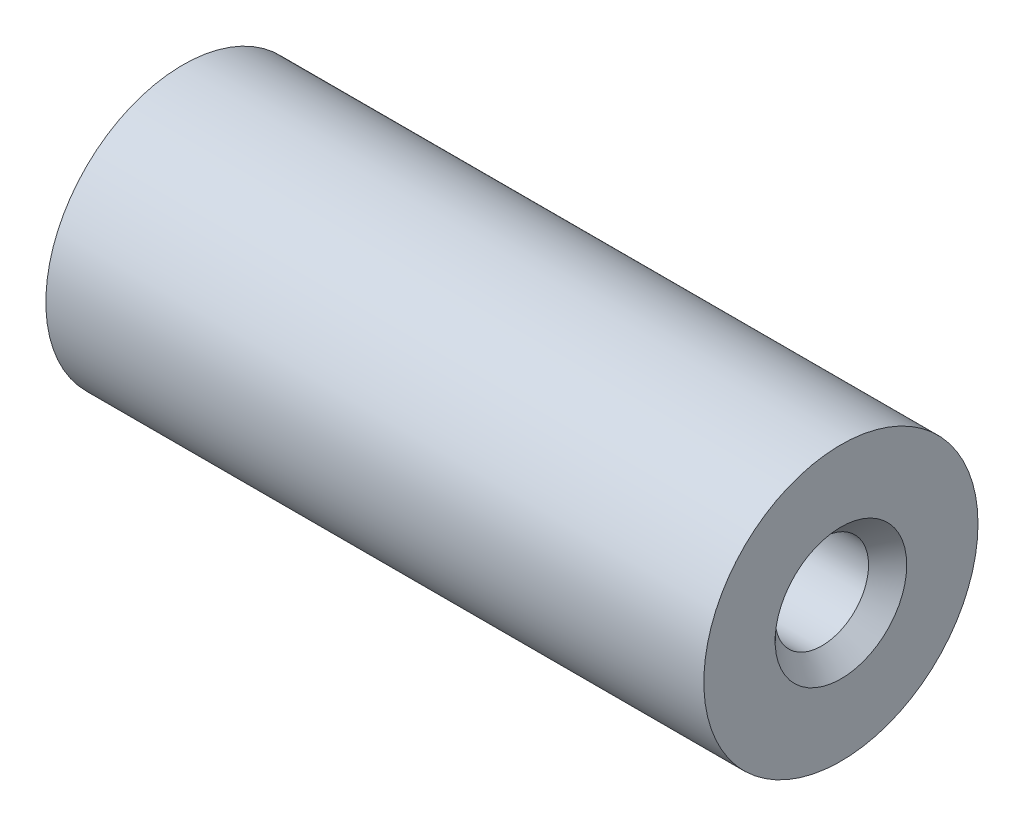
from build123d import *

# Parameters (mm, degrees)
SKETCH1_W                         = 38.1
SKETCH1_H                         = 7.9375
F_1_4_28_TAPPED_HOLE1_D           = 5.4102
F_1_4_28_TAPPED_HOLE1_DEPTH       = 12.7
F_1_4_28_TAPPED_HOLE1_CSINK_D     = 7.62
F_1_4_28_TAPPED_HOLE1_CSINK_ANGLE = 90
F_1_4_28_TAPPED_HOLE1_TIP         = 1.625388061
F_7_16_28_TAPPED_HOLE_D           = 6.9088
F_7_16_28_TAPPED_HOLE_DEPTH       = 12.7
F_7_16_28_TAPPED_HOLE_CSINK_D     = 9.2075
F_7_16_28_TAPPED_HOLE_CSINK_ANGLE = 90
F_7_16_28_TAPPED_HOLE_TIP         = 2.075612922


with BuildPart() as part:
    # Sketch1 → Revolve1 (revolve)
    with BuildSketch(Plane.XY, mode=Mode.PRIVATE) as revolve1_sk:
        with Locations((19.05, 3.96875)):
            Rectangle(SKETCH1_W, SKETCH1_H)
    revolve(revolve1_sk.sketch.rotate(Axis((0, 0, 0), (-1, 0, 0)), 90), axis=Axis((0, 0, 0), (-1, 0, 0)))

    # 1/4-28 Tapped Hole1
    with Locations(Plane(origin=(38.1, 0, 0), x_dir=(0, 0, -1), z_dir=(1, 0, 0))):
        with Locations((0, 0)):
            CounterSinkHole(F_1_4_28_TAPPED_HOLE1_D / 2, F_1_4_28_TAPPED_HOLE1_CSINK_D / 2, depth=F_1_4_28_TAPPED_HOLE1_DEPTH, counter_sink_angle=F_1_4_28_TAPPED_HOLE1_CSINK_ANGLE)
            with Locations((0, 0, -(F_1_4_28_TAPPED_HOLE1_DEPTH + F_1_4_28_TAPPED_HOLE1_TIP / 2))):  # 118° drill point
                Cone(0, F_1_4_28_TAPPED_HOLE1_D / 2, F_1_4_28_TAPPED_HOLE1_TIP, mode=Mode.SUBTRACT)

    # 7/16-28 Tapped Hole
    with Locations(Plane.ZY):
        with Locations((0, 0)):
            CounterSinkHole(F_7_16_28_TAPPED_HOLE_D / 2, F_7_16_28_TAPPED_HOLE_CSINK_D / 2, depth=F_7_16_28_TAPPED_HOLE_DEPTH, counter_sink_angle=F_7_16_28_TAPPED_HOLE_CSINK_ANGLE)
            with Locations((0, 0, -(F_7_16_28_TAPPED_HOLE_DEPTH + F_7_16_28_TAPPED_HOLE_TIP / 2))):  # 118° drill point
                Cone(0, F_7_16_28_TAPPED_HOLE_D / 2, F_7_16_28_TAPPED_HOLE_TIP, mode=Mode.SUBTRACT)


solid = part.part
